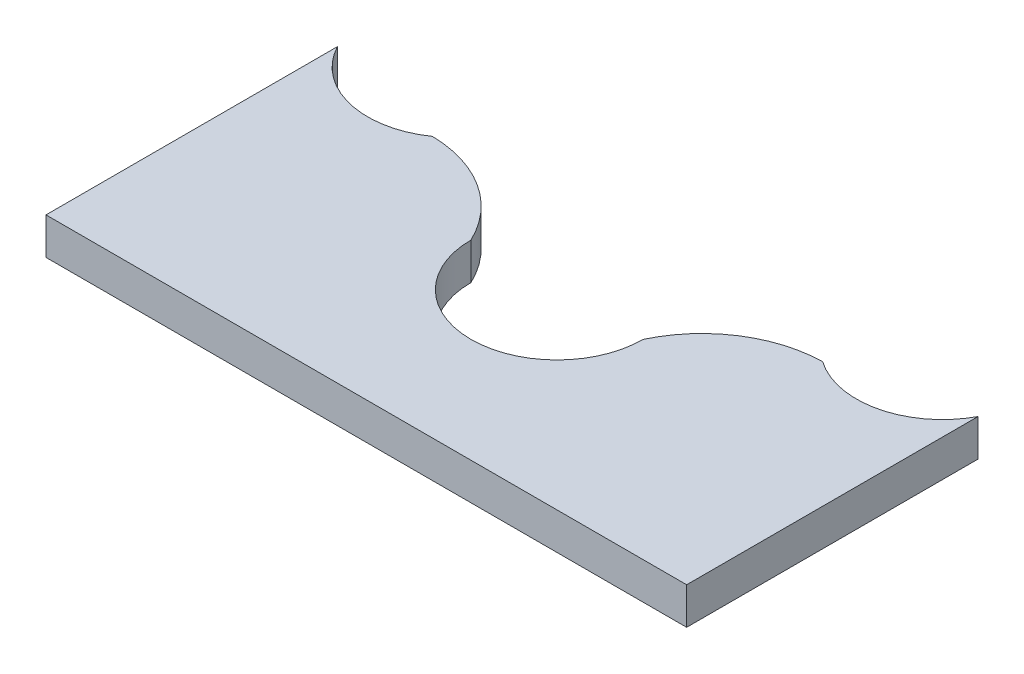
from build123d import *

# Parameters (mm, degrees)
BOSS_EXTRUDE1_DEPTH = 3


with BuildPart() as part:
    # Sketch2 → Boss-Extrude1 (new body)
    with BuildSketch(Plane(origin=(0, 0, 0), x_dir=(1, 0, 0), z_dir=(0, 1, 0))):
        with BuildLine():
            Line((26.055569119, 8.188046441), (26.055569119, -15.511162218))
            Line((26.055569119, -15.511162218), (-26.055569119, -15.511162218))
            Line((-26.055569119, -15.511162218), (-26.055569119, 8.188046441))
            ThreePointArc((-26.055569119, 8.188046441), (-21.514872246, 4.669726518), (-15.870079226, 5.73406431))
            ThreePointArc((-15.870079226, 5.73406431), (-10.616247764, 4.133629141), (-7, 0))
            ThreePointArc((-7, 0), (0, -7), (7, 0))
            ThreePointArc((7, 0), (10.616247764, 4.133629141), (15.870079226, 5.73406431))
            ThreePointArc((15.870079226, 5.73406431), (21.514872246, 4.669726518), (26.055569119, 8.188046441))
        make_face()
    extrude(amount=BOSS_EXTRUDE1_DEPTH)


solid = part.part
